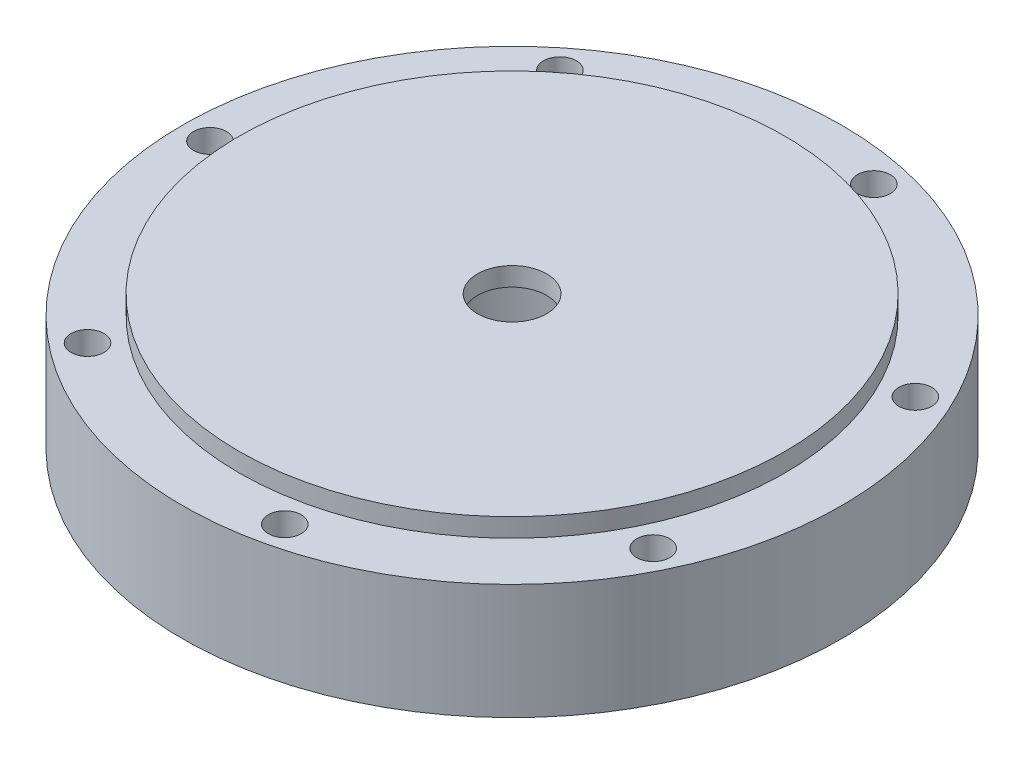
from build123d import *

# Parameters (mm, degrees)
CROQUIS1_R              = 30
SALIENTE_EXTRUIR1_DEPTH = 10.5
CROQUIS2_R              = 24.85
SALIENTE_EXTRUIR2_DEPTH = 1.7
CROQUIS4_R              = 1.5
CORTAR_EXTRUIR1_DEPTH   = 44.706406853
CORTAR_EXTRUIR2_DEPTH   = 10.5
CROQUIS6_R              = 3.15
CORTAR_EXTRUIR3_DEPTH   = 45.145667964


with BuildPart() as part:
    # Croquis1 → Saliente-Extruir1 (new body)
    with BuildSketch(Plane(origin=(0, 0, 0), x_dir=(1, 0, 0), z_dir=(0, 1, 0))):
        with Locations(Location((0, 0, 0), (0, 0, 90))):
            Circle(CROQUIS1_R)
    extrude(amount=SALIENTE_EXTRUIR1_DEPTH)

    # Croquis2 → Saliente-Extruir2 (add)
    with BuildSketch(Plane(origin=(0, 10.5, 0), x_dir=(1, 0, 0), z_dir=(0, 1, 0))):
        with Locations(Location((0, 0, 0), (0, 0, 270))):
            Circle(CROQUIS2_R)
    extrude(amount=SALIENTE_EXTRUIR2_DEPTH)

    # Croquis4 → Cortar-Extruir1 (cut, through all)
    with BuildSketch(Plane(origin=(0, 10.5, 0), x_dir=(1, 0, 0), z_dir=(0, 1, 0))):
        with Locations(Location((-27.5, 0, 0), (0, 0, 270))):
            Circle(CROQUIS4_R)
        with Locations(Location((-17.145969551, 21.500365768, 0), (0, 0, 270))):
            Circle(CROQUIS4_R)
        with Locations(Location((6.119325684, 26.810517585, 0), (0, 0, 270))):
            Circle(CROQUIS4_R)
        with Locations(Location((24.776643867, 11.931802826, 0), (0, 0, 270))):
            Circle(CROQUIS4_R)
        with Locations(Location((24.776643867, -11.931802826, 0), (0, 0, 270))):
            Circle(CROQUIS4_R)
        with Locations(Location((6.119325684, -26.810517585, 0), (0, 0, 270))):
            Circle(CROQUIS4_R)
        with Locations(Location((-17.145969551, -21.500365768, 0), (0, 0, 270))):
            Circle(CROQUIS4_R)
    extrude(amount=-CORTAR_EXTRUIR1_DEPTH, mode=Mode.SUBTRACT)

    # Croquis5 → Cortar-Extruir2 (cut)
    with BuildSketch(Plane.XZ):
        with BuildLine():
            Line((-4.135214626, 9.05), (4.135214626, 9.05))
            ThreePointArc((4.135214626, 9.05), (4.370264873, 9.021983221), (4.592144419, 8.939502762))
            ThreePointArc((4.592144419, 8.939502762), (10.05, 0), (4.592144419, -8.939502762))
            ThreePointArc((4.592144419, -8.939502762), (4.370264873, -9.021983221), (4.135214626, -9.05))
            Line((4.135214626, -9.05), (-4.135214626, -9.05))
            ThreePointArc((-4.135214626, -9.05), (-4.370264873, -9.021983221), (-4.592144419, -8.939502762))
            ThreePointArc((-4.592144419, -8.939502762), (-10.05, 0), (-4.592144419, 8.939502762))
            ThreePointArc((-4.592144419, 8.939502762), (-4.370264873, 9.021983221), (-4.135214626, 9.05))
        make_face()
    extrude(amount=-CORTAR_EXTRUIR2_DEPTH, mode=Mode.SUBTRACT)

    # Croquis6 → Cortar-Extruir3 (cut, through all)
    with BuildSketch(Plane(origin=(0, 12.2, 0), x_dir=(1, 0, 0), z_dir=(0, 1, 0))):
        with Locations(Location((0, 0, 0), (0, 0, 270))):
            Circle(CROQUIS6_R)
    extrude(amount=-CORTAR_EXTRUIR3_DEPTH, mode=Mode.SUBTRACT)


solid = part.part
